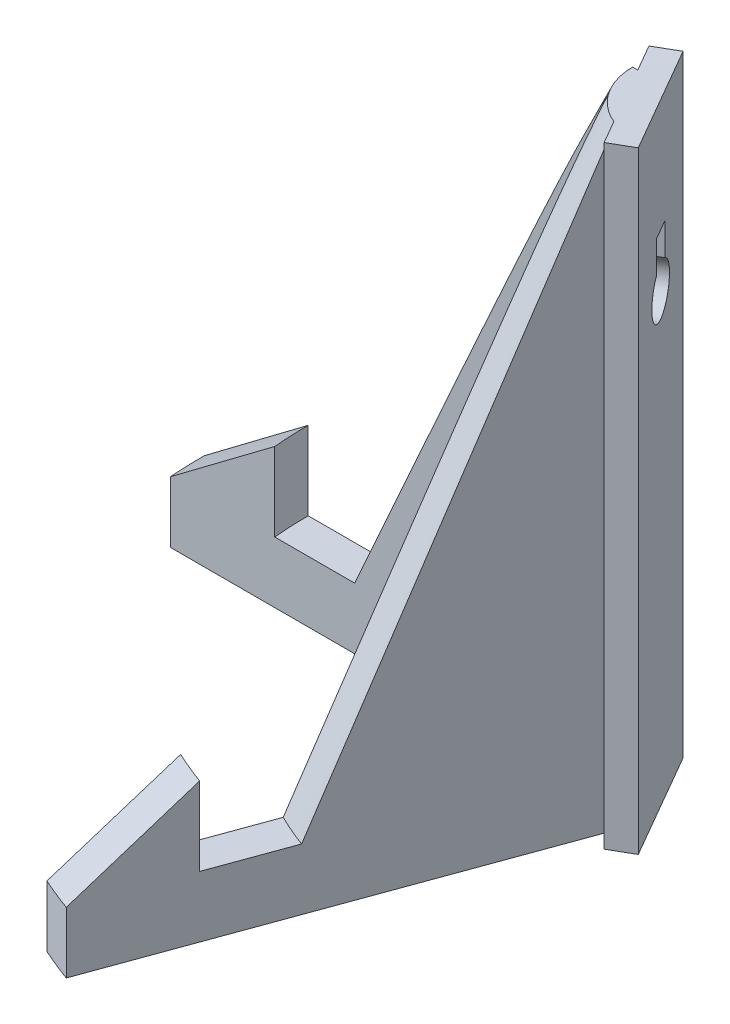
from build123d import *

# Parameters (mm, degrees)
REVOLVE1_ANGLE          = 70
CUT_EXTRUDE1_DEPTH      = 149.496943463
CUT_EXTRUDE1_DEPTH_BACK = 149.496943463
BOSS_EXTRUDE1_DEPTH     = 100
CUT_EXTRUDE2_DEPTH      = 100
CUT_EXTRUDE2_DEPTH_BACK = 100
CUT_EXTRUDE4_DEPTH      = 100


with BuildPart() as part:
    # Sketch3 → Revolve1 (revolve)
    with BuildSketch(Plane.XY):
        Polygon((0, 0), (80, 0), (80, 100), (70, 100), (30, 10), (17, 10), (17, 22.809585309), (0, 10), align=None)
    revolve(axis=Axis((80, 0, 0), (0, 1, 0)), revolution_arc=REVOLVE1_ANGLE)

    # Sketch5 → Cut-Extrude1 (cut, two sides: drawn at the far end of the back side and taken through both)
    with BuildSketch(Plane(origin=(0, 0, 0), x_dir=(1, 0, 0), z_dir=(0, 1, 0)).offset(-CUT_EXTRUDE1_DEPTH_BACK)):
        Polygon((0.205883631, -5.735764364), (71.808479557, -5.735764364), (47.318949436, -73.020195385), (2.210062516, -73.020195385), align=None)
    extrude(amount=CUT_EXTRUDE1_DEPTH + CUT_EXTRUDE1_DEPTH_BACK, mode=Mode.SUBTRACT)

    # Sketch7 → Boss-Extrude1 (add)
    with BuildSketch(Plane(origin=(0, 100, 0), x_dir=(1, 0, 0), z_dir=(0, 1, 0))):
        Polygon((71.890204546, 6.360873716), (81.890204546, -10.95963436), (78.353805314, -13.001375409), (68.353805314, 4.319132667), align=None)
    extrude(amount=-BOSS_EXTRUDE1_DEPTH)

    # Sketch8 → Cut-Extrude2 (cut, two sides: drawn at the far end of the back side and taken through both)
    with BuildSketch(Plane(origin=(0, 0, 0), x_dir=(1, 0, 0), z_dir=(0, 1, 0)).offset(-CUT_EXTRUDE2_DEPTH_BACK)):
        Polygon((71.890204546, 6.360873716), (81.890204546, -10.95963436), (87.183786138, 1.252005023), align=None)
    extrude(amount=CUT_EXTRUDE2_DEPTH + CUT_EXTRUDE2_DEPTH_BACK, mode=Mode.SUBTRACT)

    # Sketch9 → Cut-Extrude4 (cut)
    with BuildSketch(Plane(origin=(56.671992524, 0, -32.719590139), x_dir=(-0.4999999999999999, 0, -0.8660254037844387), z_dir=(0.8660254037844388, 0, -0.49999999999999994))):
        with BuildLine():
            Line((-42.376179883, 81.575757576), (-38.496668208, 81.575757576))
            Line((-38.496668208, 81.575757576), (-38.496668208, 76.289944384))
            ThreePointArc((-38.496668208, 76.289944384), (-40.436424045, 68.929279342), (-42.376179883, 76.289944384))
            Line((-42.376179883, 76.289944384), (-42.376179883, 81.575757576))
        make_face()
    extrude(amount=-CUT_EXTRUDE4_DEPTH, mode=Mode.SUBTRACT)


solid = part.part
